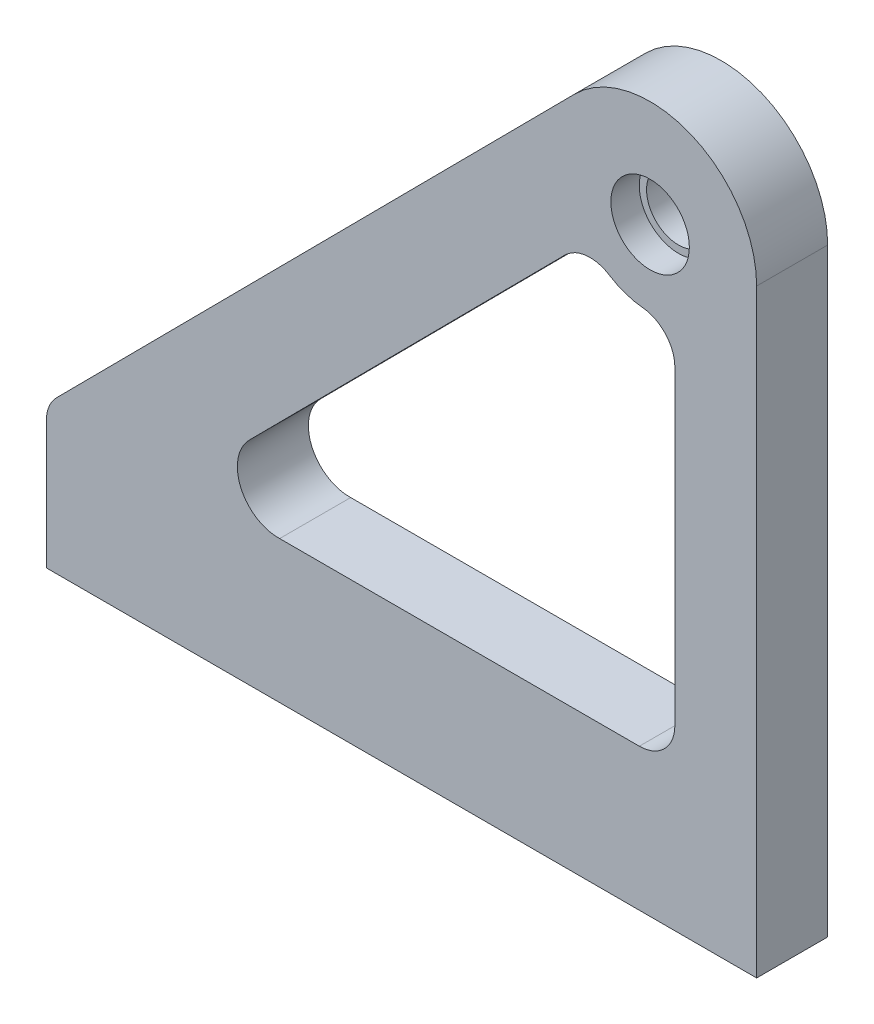
from build123d import *

# Parameters (mm, degrees)
SKETCH2_R           = 5.525
BOSS_EXTRUDE1_DEPTH = 10
SKETCH4_R           = 5.125
CUT_EXTRUDE2_DEPTH  = 7
SKETCH5_R           = 5.525
SKETCH5_R_2         = 4.5
BOSS_EXTRUDE4_DEPTH = 6


with BuildPart() as part:
    # Sketch2 → Boss-Extrude1 (new body)
    with BuildSketch(Plane.XY):
        with BuildLine():
            Line((-88.62562975, 0.527091372), (-88.62562975, -17.425503603))
            Line((-88.62562975, -17.425503603), (11.37437025, -17.425503603))
            Line((11.37437025, -17.425503603), (11.37437025, 2.574496397))
            Line((11.37437025, 2.574496397), (11.37437025, 66.938471641))
            ThreePointArc((11.37437025, 66.938471641), (2.08841102, 80.807492446), (-14.272261494, 77.504891684))
            Line((-14.272261494, 77.504891684), (-87.174506998, 4.049231386))
            ThreePointArc((-87.174506998, 4.049231386), (-88.248636685, 2.431771629), (-88.62562975, 0.527091372))
        make_face()
        with BuildLine():
            ThreePointArc((-55.776519908, 2.574496397), (-61.255836785, 6.063207717), (-60.051592087, 12.446295905))
            Line((-60.051592087, 12.446295905), (-15.620909093, 57.214260654))
            ThreePointArc((-15.620909093, 57.214260654), (-12.624755601, 58.661476378), (-9.38382576, 57.907989239))
            ThreePointArc((-9.38382576, 57.907989239), (-7.11800033, 56.813760216), (-4.659411057, 56.278371739))
            ThreePointArc((-4.659411057, 56.278371739), (-1.43979486, 54.662291481), (-0.142030474, 51.301718396))
            Line((-0.142030474, 51.301718396), (-0.142030474, 7.574496397))
            ThreePointArc((-0.142030474, 7.574496397), (-1.606496568, 4.038962491), (-5.142030474, 2.574496397))
            Line((-5.142030474, 2.574496397), (-55.776519908, 2.574496397))
        make_face(mode=Mode.SUBTRACT)
        with Locations((-3.62562975, 66.938471641)):
            Circle(SKETCH2_R, mode=Mode.SUBTRACT)
    extrude(amount=BOSS_EXTRUDE1_DEPTH)

    # Sketch4 → Cut-Extrude2 (cut)
    with BuildSketch(Plane.XZ.offset(17.425503603)):
        with Locations((-78.62562975, 2.5)):
            Circle(SKETCH4_R)
        with Locations((1.37437025, 2.5)):
            Circle(SKETCH4_R)
    extrude(amount=-CUT_EXTRUDE2_DEPTH, mode=Mode.SUBTRACT)

    # Sketch5 → Boss-Extrude4 (add)
    with BuildSketch(Plane(origin=(0, 0, 0), x_dir=(-1, 0, 0), z_dir=(0, 0, -1))):
        with Locations((3.62562975, 66.938471641)):
            Circle(SKETCH5_R)
        with Locations((3.62562975, 66.938471641)):
            Circle(SKETCH5_R_2, mode=Mode.SUBTRACT)
    extrude(amount=-BOSS_EXTRUDE4_DEPTH)


solid = part.part
